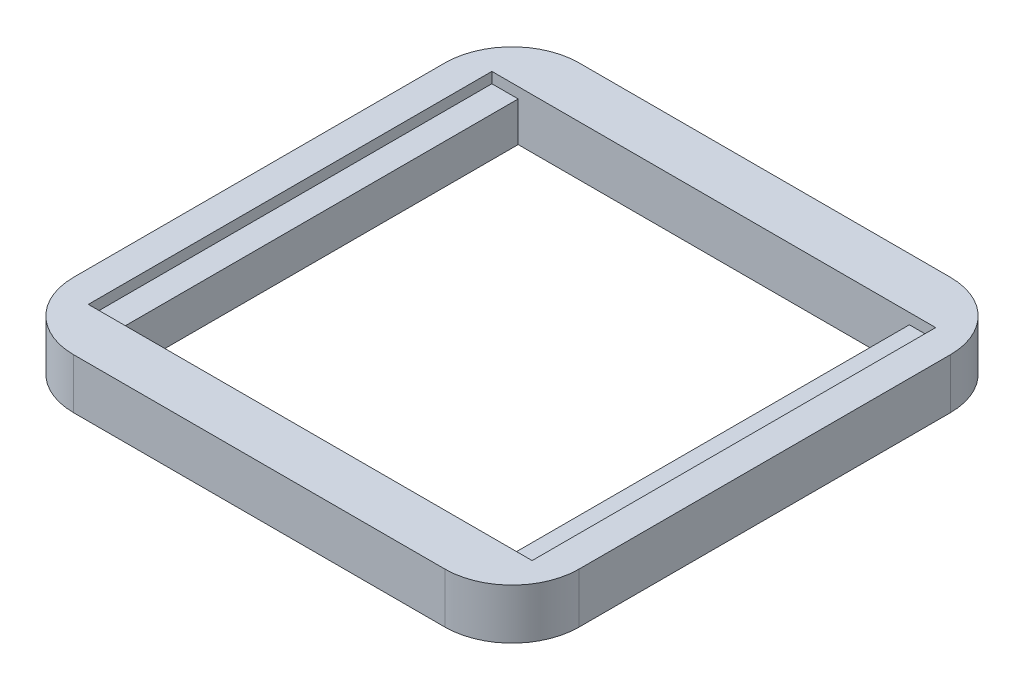
from build123d import *

# Parameters (mm, degrees)
SKETCH1_W             = 75.4
SKETCH1_H             = 75.4
BASE_DEPTH            = 7.5
SKETCH2_W             = 66.2
SKETCH2_H             = 60.2
SLOT_DEPTH            = 1.6
SKETCH3_W             = 58.357887306
SKETCH3_H             = 60.2
SLOT_COMPONENTS_DEPTH = 5.9
FILLET2_R             = 10


with BuildPart() as part:
    # Sketch1 → Base (new body)
    with BuildSketch(Plane(origin=(0, 0, 0), x_dir=(1, 0, 0), z_dir=(0, 1, 0))):
        Rectangle(SKETCH1_W, SKETCH1_H)
    extrude(amount=BASE_DEPTH)

    # Sketch2 → Slot (cut)
    with BuildSketch(Plane(origin=(0, 7.5, 0), x_dir=(1, 0, 0), z_dir=(0, 1, 0))):
        Rectangle(SKETCH2_W, SKETCH2_H)
    extrude(amount=-SLOT_DEPTH, mode=Mode.SUBTRACT)

    # Sketch3 → Slot-Components (cut)
    with BuildSketch(Plane(origin=(0, 5.9, 0), x_dir=(1, 0, 0), z_dir=(0, 1, 0))):
        Rectangle(SKETCH3_W, SKETCH3_H)
    extrude(amount=-SLOT_COMPONENTS_DEPTH, mode=Mode.SUBTRACT)

    # Fillet2
    fillet2_edges = [part.edges().sort_by_distance(p)[0] for p in [
        (37.7, 3.75, 37.7),
        (-37.7, 3.75, 37.7),
        (-37.7, 3.75, -37.7),
        (37.7, 3.75, -37.7),
    ]]
    fillet(fillet2_edges, radius=FILLET2_R)


solid = part.part
